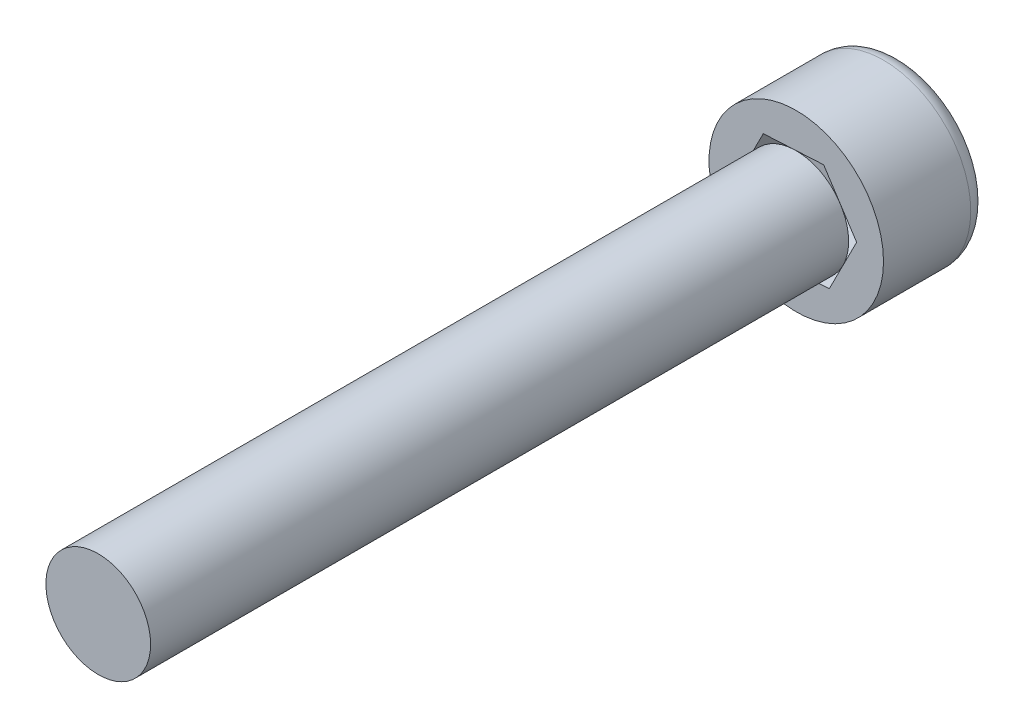
from build123d import *

# Parameters (mm, degrees)
SKETCH1_R           = 2.5
BOSS_EXTRUDE1_DEPTH = 3
SKETCH2_R           = 1.5
BOSS_EXTRUDE2_DEPTH = 20
CUT_EXTRUDE1_DEPTH  = 3
FILLET1_R           = 0.5


with BuildPart() as part:
    # Sketch1 → Boss-Extrude1 (new body)
    with BuildSketch(Plane.XY):
        Circle(SKETCH1_R)
    extrude(amount=BOSS_EXTRUDE1_DEPTH)

    # Sketch2 → Boss-Extrude2 (add)
    with BuildSketch(Plane.XY.offset(3)):
        Circle(SKETCH2_R)
    extrude(amount=BOSS_EXTRUDE2_DEPTH)

    # Sketch3 → Cut-Extrude1 (cut)
    with BuildSketch(Plane(origin=(0, 0, 0), x_dir=(-1, 0, 0), z_dir=(0, 0, -1))):
        Polygon((0.784462107, -1.544221229), (1.729565866, -0.092746502), (0.94510376, 1.451474727), (-0.784462107, 1.544221229), (-1.729565866, 0.092746502), (-0.94510376, -1.451474727), align=None)
    extrude(amount=-CUT_EXTRUDE1_DEPTH, mode=Mode.SUBTRACT)


with BuildPart() as cut_extrude1_piece_1:
    # of the separate pieces the step leaves, piece 1, a body of its own (cut_extrude1_pieces)
    add(part.part.solids().sort_by_distance((1.5, 0, 3))[0])


with BuildPart() as cut_extrude1_piece_2:
    # of the separate pieces the step leaves, piece 2, a body of its own (cut_extrude1_pieces)
    add(part.part.solids().sort_by_distance((2.5, 0, 0))[0])

    # Fillet1
    fillet1_edges = [cut_extrude1_piece_2.edges().sort_by_distance(p)[0] for p in [
        (-2.5, 0, 0),
    ]]
    fillet(fillet1_edges, radius=FILLET1_R)


solid = Compound([cut_extrude1_piece_1.part, cut_extrude1_piece_2.part])
